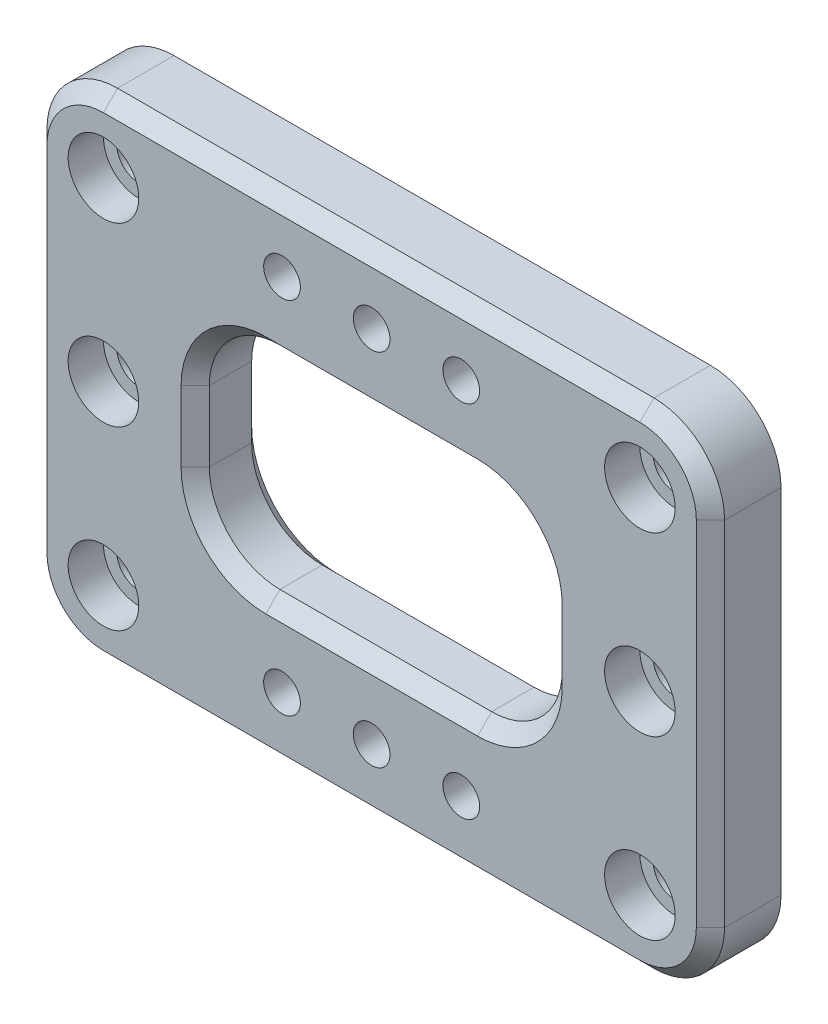
from build123d import *

# Parameters (mm, degrees)
SKETCH_1_W          = 96
SKETCH_1_H          = 70
EXTRUDE_1_DEPTH     = 10
FILLET_1_R          = 10
SKETCH_2_R          = 2.6
CUT_EXTRUDE_1_DEPTH = 10
SKETCH_3_R          = 5
CUT_EXTRUDE_2_DEPTH = 5
SKETCH_4_R          = 3.1
CUT_EXTRUDE_3_DEPTH = 5
CHAMFER_1_SIZE      = 1
CHAMFER_2_SIZE      = 2
SKETCH_5_W          = 50
SKETCH_5_H          = 30
CUT_EXTRUDE_4_DEPTH = 10
FILLET_2_R          = 10
CHAMFER_3_SIZE      = 2


with BuildPart() as part:
    # 草图1 → 凸台-拉伸1 (new body)
    with BuildSketch(Plane.XY):
        Rectangle(SKETCH_1_W, SKETCH_1_H)
    extrude(amount=EXTRUDE_1_DEPTH)

    # 圆角1
    fillet_1_edges = [part.edges().sort_by_distance(p)[0] for p in [
        (48, -35, 5),
        (-48, -35, 5),
        (-48, 35, 5),
        (48, 35, 5),
    ]]
    fillet(fillet_1_edges, radius=FILLET_1_R)

    # 草图2 → 切除-拉伸1 (cut)
    with BuildSketch(Plane.XY.offset(10)):
        with Locations((0, 25.5)):
            Circle(SKETCH_2_R)
        with Locations((-12.7, 25.5)):
            Circle(SKETCH_2_R)
        with Locations(Location((12.7, 25.5, 0), (0, 0, 180))):
            Circle(SKETCH_2_R)
        with Locations((-12.7, -25.5)):
            Circle(SKETCH_2_R)
        with Locations((0, -25.5)):
            Circle(SKETCH_2_R)
        with Locations((12.7, -25.5)):
            Circle(SKETCH_2_R)
    extrude(amount=-CUT_EXTRUDE_1_DEPTH, mode=Mode.SUBTRACT)

    # 草图3 → 切除-拉伸2 (cut)
    with BuildSketch(Plane.XY.offset(10)):
        with Locations((-38, 25)):
            Circle(SKETCH_3_R)
        with Locations((-38, 0)):
            Circle(SKETCH_3_R)
        with Locations((-38, -25)):
            Circle(SKETCH_3_R)
        with Locations(Location((38, -25, 0), (0, 0, 180))):
            Circle(SKETCH_3_R)
        with Locations(Location((38, 0, 0), (0, 0, 180))):
            Circle(SKETCH_3_R)
        with Locations(Location((38, 25, 0), (0, 0, 180))):
            Circle(SKETCH_3_R)
    extrude(amount=-CUT_EXTRUDE_2_DEPTH, mode=Mode.SUBTRACT)

    # 草图4 → 切除-拉伸3 (cut)
    with BuildSketch(Plane.XY.offset(5)):
        with Locations((-38, 25)):
            Circle(SKETCH_4_R)
        with Locations((-38, 0)):
            Circle(SKETCH_4_R)
        with Locations((-38, -25)):
            Circle(SKETCH_4_R)
        with Locations((38, 25)):
            Circle(SKETCH_4_R)
        with Locations((38, 0)):
            Circle(SKETCH_4_R)
        with Locations((38, -25)):
            Circle(SKETCH_4_R)
    extrude(amount=-CUT_EXTRUDE_3_DEPTH, mode=Mode.SUBTRACT)

    # 倒角1
    chamfer_1_edges = [part.edges().sort_by_distance(p)[0] for p in [
        (34.9, 0, 0),
        (34.9, -25, 0),
        (-41.1, 25, 0),
        (-41.1, 0, 0),
        (-41.1, -25, 0),
        (34.9, 25, 0),
    ]]
    chamfer(chamfer_1_edges, length=CHAMFER_1_SIZE)

    # 倒角2
    chamfer_2_edges = [part.edges().sort_by_distance(p)[0] for p in [
        (0, 35, 10),
        (48, 0, 10),
        (-48, 0, 10),
        (0, -35, 10),
        (-45.071067812, -32.071067812, 10),
        (45.071067812, -32.071067812, 10),
        (-45.071067812, 32.071067812, 10),
        (45.071067812, 32.071067812, 10),
    ]]
    chamfer(chamfer_2_edges, length=CHAMFER_2_SIZE)

    # 草图5 → 切除-拉伸4 (cut)
    with BuildSketch(Plane.XY.offset(10)):
        Rectangle(SKETCH_5_W, SKETCH_5_H)
    extrude(amount=-CUT_EXTRUDE_4_DEPTH, mode=Mode.SUBTRACT)

    # 圆角2
    fillet_2_edges = [part.edges().sort_by_distance(p)[0] for p in [
        (25, 15, 5),
        (25, -15, 5),
        (-25, -15, 5),
        (-25, 15, 5),
    ]]
    fillet(fillet_2_edges, radius=FILLET_2_R)

    # 倒角3
    chamfer_3_edges = [part.edges().sort_by_distance(p)[0] for p in [
        (25, 0, 10),
        (25, 0, 0),
        (0, -15, 10),
        (0, -15, 0),
        (0, 15, 10),
        (0, 15, 0),
        (-25, 0, 10),
        (-25, 0, 0),
        (22.071067812, -12.071067812, 10),
        (22.071067812, -12.071067812, 0),
        (22.071067812, 12.071067812, 10),
        (22.071067812, 12.071067812, 0),
        (-22.071067812, -12.071067812, 10),
        (-22.071067812, -12.071067812, 0),
        (-22.071067812, 12.071067812, 10),
        (-22.071067812, 12.071067812, 0),
    ]]
    chamfer(chamfer_3_edges, length=CHAMFER_3_SIZE)


solid = part.part
